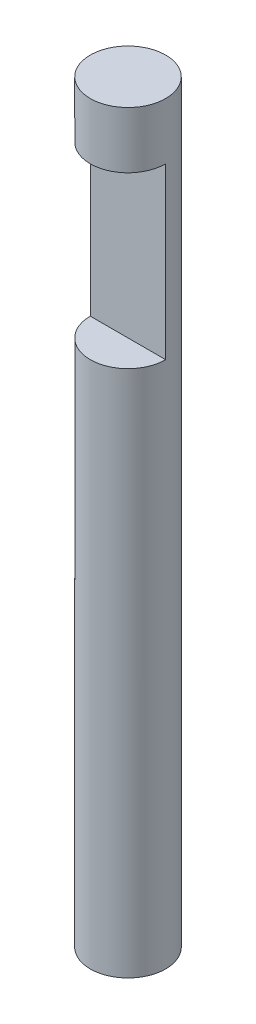
from build123d import *

# Parameters (mm, degrees)
SKETCH1_R           = 2
BOSS_EXTRUDE1_DEPTH = 28
BOSS_EXTRUDE2_DEPTH = 9
SKETCH3_R           = 2
BOSS_EXTRUDE3_DEPTH = 3


with BuildPart() as part:
    # Sketch1 → Boss-Extrude1 (new body)
    with BuildSketch(Plane(origin=(0, 0, 0), x_dir=(1, 0, 0), z_dir=(0, 1, 0))):
        with Locations(Location((0, 0, 0), (0, 0, 270))):
            Circle(SKETCH1_R)
    extrude(amount=BOSS_EXTRUDE1_DEPTH)

    # Sketch2 → Boss-Extrude2 (add)
    with BuildSketch(Plane(origin=(0, 28, 0), x_dir=(1, 0, 0), z_dir=(0, 1, 0))):
        with BuildLine():
            Line((-2, 0), (2, 0))
            ThreePointArc((2, 0), (0, 2), (-2, 0))
        make_face()
    extrude(amount=BOSS_EXTRUDE2_DEPTH)

    # Sketch3 → Boss-Extrude3 (add)
    with BuildSketch(Plane(origin=(0, 37, 0), x_dir=(1, 0, 0), z_dir=(0, 1, 0))):
        with Locations(Location((0, 0, 0), (0, 0, 270))):
            Circle(SKETCH3_R)
    extrude(amount=BOSS_EXTRUDE3_DEPTH)


solid = part.part
